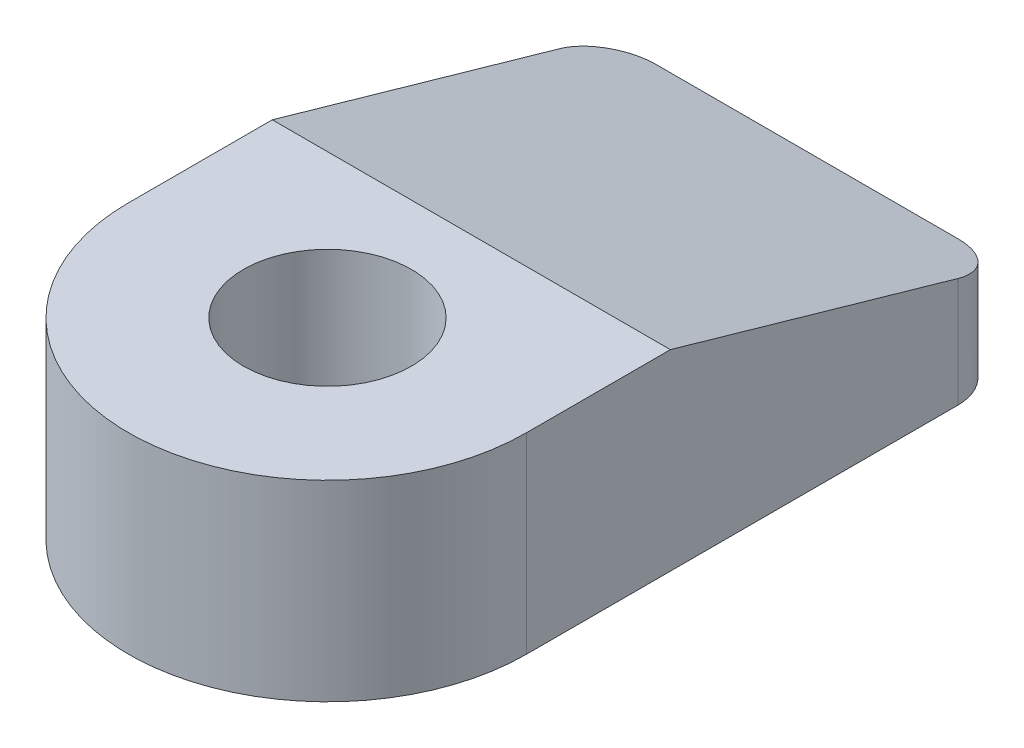
from build123d import *

# Parameters (mm, degrees)
SCHIZZO1_R                   = 1.75
ESTRUSIONE_ESTRUSIONE1_DEPTH = 4
TAGLIO_ESTRUSIONE1_DEPTH     = 14.597426227
RACCORDO1_R                  = 1


with BuildPart() as part:
    # Schizzo1 → Estrusione-Estrusione1 (new body)
    with BuildSketch(Plane(origin=(0, 0, 0), x_dir=(1, 0, 0), z_dir=(0, 1, 0))):
        with BuildLine():
            Line((-4.15, 0), (-4.15, 10))
            Line((-4.15, 10), (4.15, 10))
            Line((4.15, 10), (4.15, 0))
            ThreePointArc((4.15, 0), (0, -4.15), (-4.15, 0))
        make_face()
        with Locations(Location((0, 0, 0), (0, 0, 270))):
            Circle(SCHIZZO1_R, mode=Mode.SUBTRACT)
    extrude(amount=ESTRUSIONE_ESTRUSIONE1_DEPTH)

    # Schizzo2 → Taglio-Estrusione1 (cut, through all)
    with BuildSketch(Plane(origin=(4.15, 0, 0), x_dir=(0, 0, -1), z_dir=(1, 0, 0))):
        Polygon((10, 2), (10, 4), (3, 4), align=None)
    extrude(amount=-TAGLIO_ESTRUSIONE1_DEPTH, mode=Mode.SUBTRACT)

    # Raccordo1
    raccordo1_edges = [part.edges().sort_by_distance(p)[0] for p in [
        (-4.15, 1, -10),
        (4.15, 1, -10),
    ]]
    fillet(raccordo1_edges, radius=RACCORDO1_R)


solid = part.part
